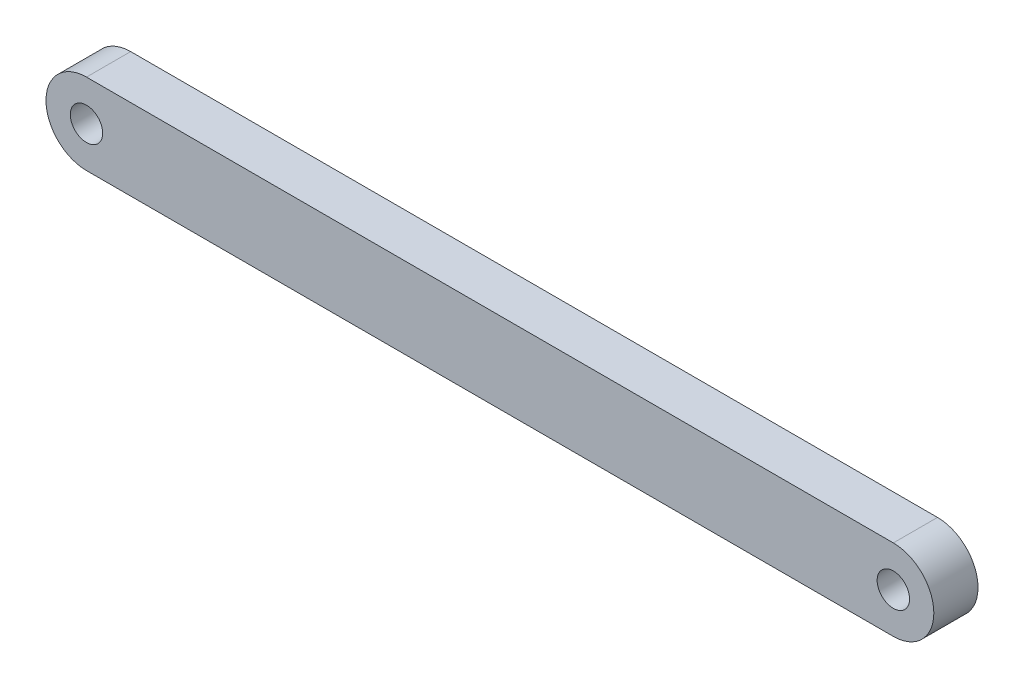
from build123d import *

# Parameters (mm, degrees)
BOSS_EXTRUDE1_DEPTH = 3
SKETCH2_R           = 1.1
CUT_EXTRUDE1_DEPTH  = 3


with BuildPart() as part:
    # Sketch1 → Boss-Extrude1 (new body)
    with BuildSketch(Plane.XY):
        with BuildLine():
            Line((-10.989332563, 2.75), (43.810667437, 2.75))
            ThreePointArc((43.810667437, 2.75), (46.560667437, 0), (43.810667437, -2.75))
            Line((43.810667437, -2.75), (-10.989332563, -2.75))
            ThreePointArc((-10.989332563, -2.75), (-13.739332563, 0), (-10.989332563, 2.75))
        make_face()
    extrude(amount=BOSS_EXTRUDE1_DEPTH)

    # Sketch2 → Cut-Extrude1 (cut)
    with BuildSketch(Plane(origin=(0, 0, 0), x_dir=(-1, 0, 0), z_dir=(0, 0, -1))):
        with Locations((10.989332563, 0)):
            Circle(SKETCH2_R)
        with Locations((-43.810667437, 0)):
            Circle(SKETCH2_R)
    extrude(amount=-CUT_EXTRUDE1_DEPTH, mode=Mode.SUBTRACT)


solid = part.part
